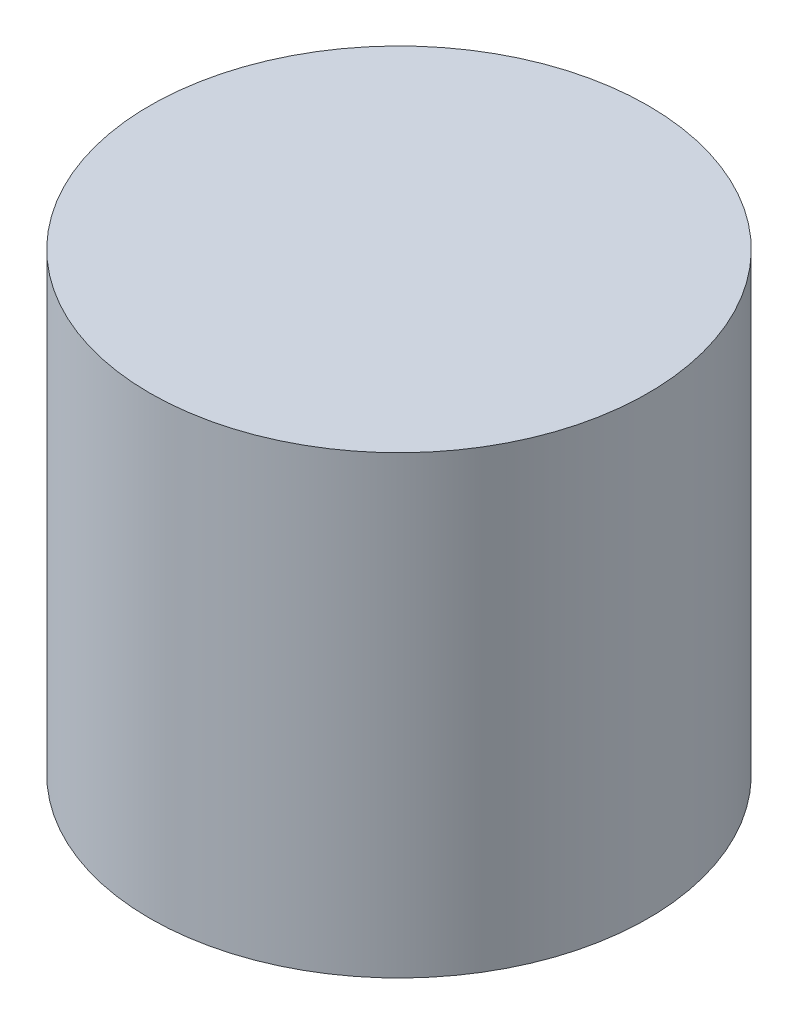
from build123d import *

# Parameters (mm, degrees)
SKETCH1_R           = 24.75
BOSS_EXTRUDE1_DEPTH = 45.2


with BuildPart() as part:
    # Sketch1 → Boss-Extrude1 (new body)
    with BuildSketch(Plane(origin=(0, 0, 0), x_dir=(1, 0, 0), z_dir=(0, 1, 0))):
        with Locations(Location((0, 0, 0), (0, 0, 270))):
            Circle(SKETCH1_R)
    extrude(amount=BOSS_EXTRUDE1_DEPTH)


solid = part.part
